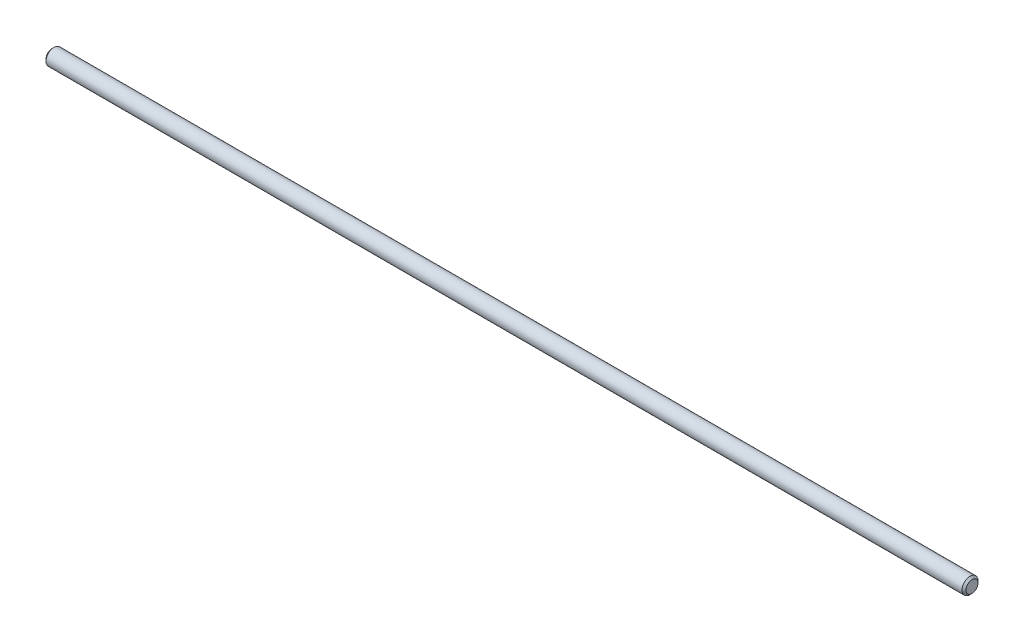
from build123d import *

# Parameters (mm, degrees)
SKETCH1_R           = 4
BOSS_EXTRUDE1_DEPTH = 230
CHAMFER1_SIZE       = 1


with BuildPart() as part:
    # Sketch1 → Boss-Extrude1 (new, symmetric)
    with BuildSketch(Plane(origin=(0, 0, 0), x_dir=(0, 0, -1), z_dir=(1, 0, 0))):
        Circle(SKETCH1_R)
    extrude(amount=BOSS_EXTRUDE1_DEPTH, both=True)

    # Chamfer1
    chamfer1_edges = [part.edges().sort_by_distance(p)[0] for p in [
        (-230, 0, 4),
        (230, 0, 4),
    ]]
    chamfer(chamfer1_edges, length=CHAMFER1_SIZE)


solid = part.part
